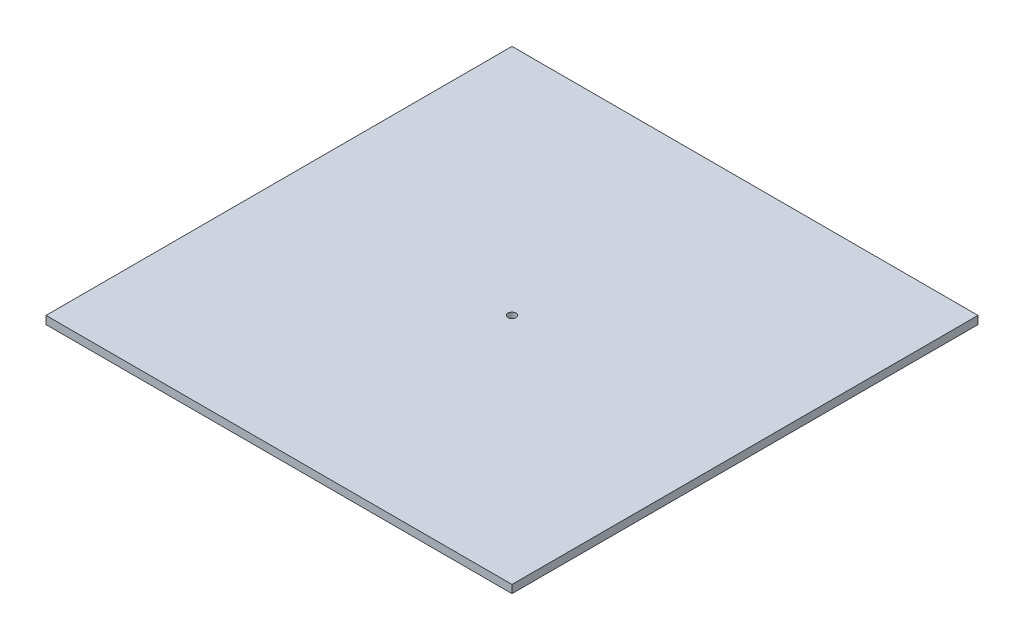
from build123d import *

# Parameters (mm, degrees)
ESQUISSE1_W                  = 350
ESQUISSE1_H                  = 350
BOSS_EXTRU_1_DEPTH           = 6
ENL_V_MAT_EXTRU_1_DEPTH      = 248.560093715
ENL_V_MAT_EXTRU_1_DEPTH_BACK = 248.560093715
ESQUISSE2_R                  = 3


with BuildPart() as part:
    # Esquisse1 → Boss.-Extru.1 (new body)
    with BuildSketch(Plane(origin=(0, 0, 0), x_dir=(1, 0, 0), z_dir=(0, 1, 0))):
        Rectangle(ESQUISSE1_W, ESQUISSE1_H)
    extrude(amount=BOSS_EXTRU_1_DEPTH)

    # Esquisse2 → Enlèv. mat.-Extru.1 (cut, two sides: drawn at the far end of the back side and taken through both)
    with BuildSketch(Plane(origin=(0, 6, 0), x_dir=(1, 0, 0), z_dir=(0, 1, 0)).offset(-ENL_V_MAT_EXTRU_1_DEPTH_BACK)):
        with Locations(Location((0, 0, 0), (0, 0, 270))):
            Circle(ESQUISSE2_R)
    extrude(amount=ENL_V_MAT_EXTRU_1_DEPTH + ENL_V_MAT_EXTRU_1_DEPTH_BACK, mode=Mode.SUBTRACT)


solid = part.part
